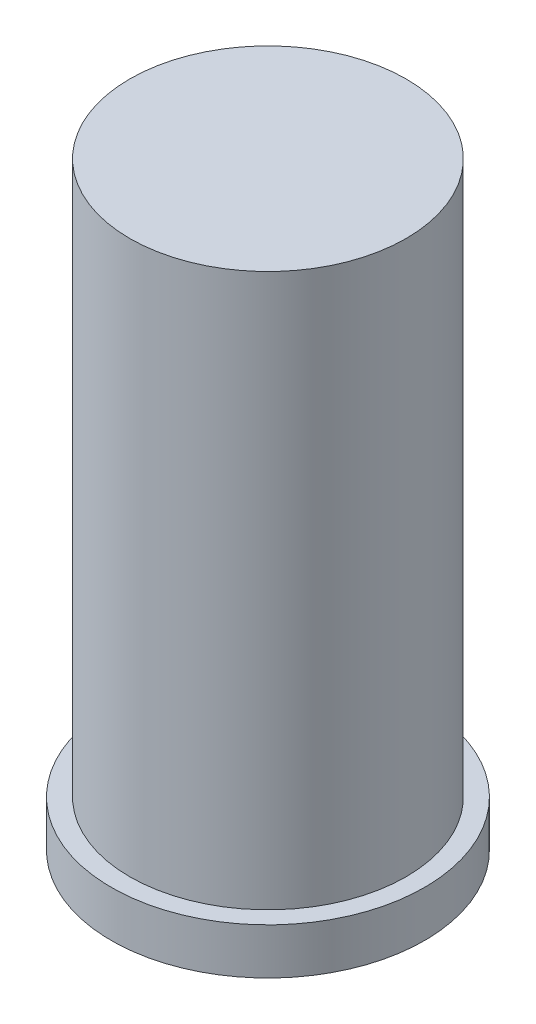
from build123d import *

# Parameters (mm, degrees)
SKETCH1_R           = 1.5
BOSS_EXTRUDE1_DEPTH = 6
SKETCH2_R           = 1.7
BOSS_EXTRUDE2_DEPTH = 0.5


with BuildPart() as part:
    # Sketch1 → Boss-Extrude1 (new body)
    with BuildSketch(Plane(origin=(0, 0, 0), x_dir=(1, 0, 0), z_dir=(0, 1, 0))):
        with Locations(Location((0, 0, 0), (0, 0, 270))):
            Circle(SKETCH1_R)
    extrude(amount=BOSS_EXTRUDE1_DEPTH)

    # Sketch2 → Boss-Extrude2 (add)
    with BuildSketch(Plane.XZ):
        with Locations(Location((0, 0, 0), (0, 0, 270))):
            Circle(SKETCH2_R)
    extrude(amount=BOSS_EXTRUDE2_DEPTH)


solid = part.part
